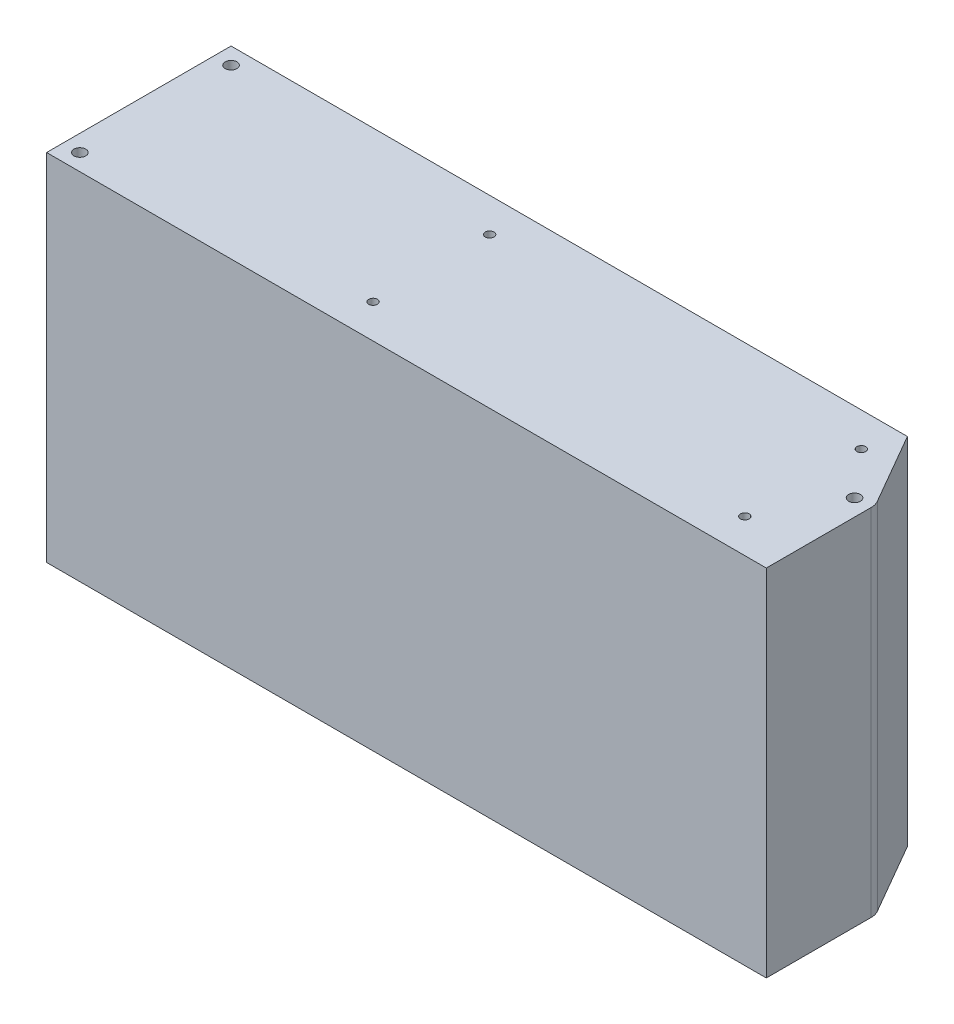
from build123d import *

# Parameters (mm, degrees)
SKETCH1_R           = 3.3782
SKETCH1_R_2         = 2.5
BOSS_EXTRUDE1_DEPTH = 203.2


with BuildPart() as part:
    # Sketch1 → Boss-Extrude1 (new body)
    with BuildSketch(Plane(origin=(0, 0, 0), x_dir=(1, 0, 0), z_dir=(0, 1, 0))):
        with BuildLine():
            Line((-205.948559195, -52.784375), (205.948559195, -52.784375))
            Line((205.948559195, -52.784375), (205.948559195, 7.252981651))
            ThreePointArc((205.948559195, 7.252981651), (205.62400269, 9.718233056), (204.672451166, 12.015481651))
            Line((204.672451166, 12.015481651), (181.134519617, 52.784375))
            Line((181.134519617, 52.784375), (-205.948559195, 52.784375))
            Line((-205.948559195, 52.784375), (-205.948559195, -52.784375))
        make_face()
        with Locations(Location((-196.423559195, 43.259375, 0), (0, 0, 270))):
            Circle(SKETCH1_R, mode=Mode.SUBTRACT)
        with Locations(Location((-196.423559195, -43.259375, 0), (0, 0, 270))):
            Circle(SKETCH1_R, mode=Mode.SUBTRACT)
        with Locations(Location((196.423559195, 7.252981651, 0), (0, 0, 270))):
            Circle(SKETCH1_R, mode=Mode.SUBTRACT)
        with Locations(Location((174.198559195, 33.3375, 0), (0, 0, 270))):
            Circle(SKETCH1_R_2, mode=Mode.SUBTRACT)
        with Locations(Location((-38.526440805, 33.3375, 0), (0, 0, 270))):
            Circle(SKETCH1_R_2, mode=Mode.SUBTRACT)
        with Locations(Location((-38.526440805, -33.3375, 0), (0, 0, 90))):
            Circle(SKETCH1_R_2, mode=Mode.SUBTRACT)
        with Locations(Location((174.198559195, -33.3375, 0), (0, 0, 90))):
            Circle(SKETCH1_R_2, mode=Mode.SUBTRACT)
    extrude(amount=BOSS_EXTRUDE1_DEPTH)


solid = part.part
